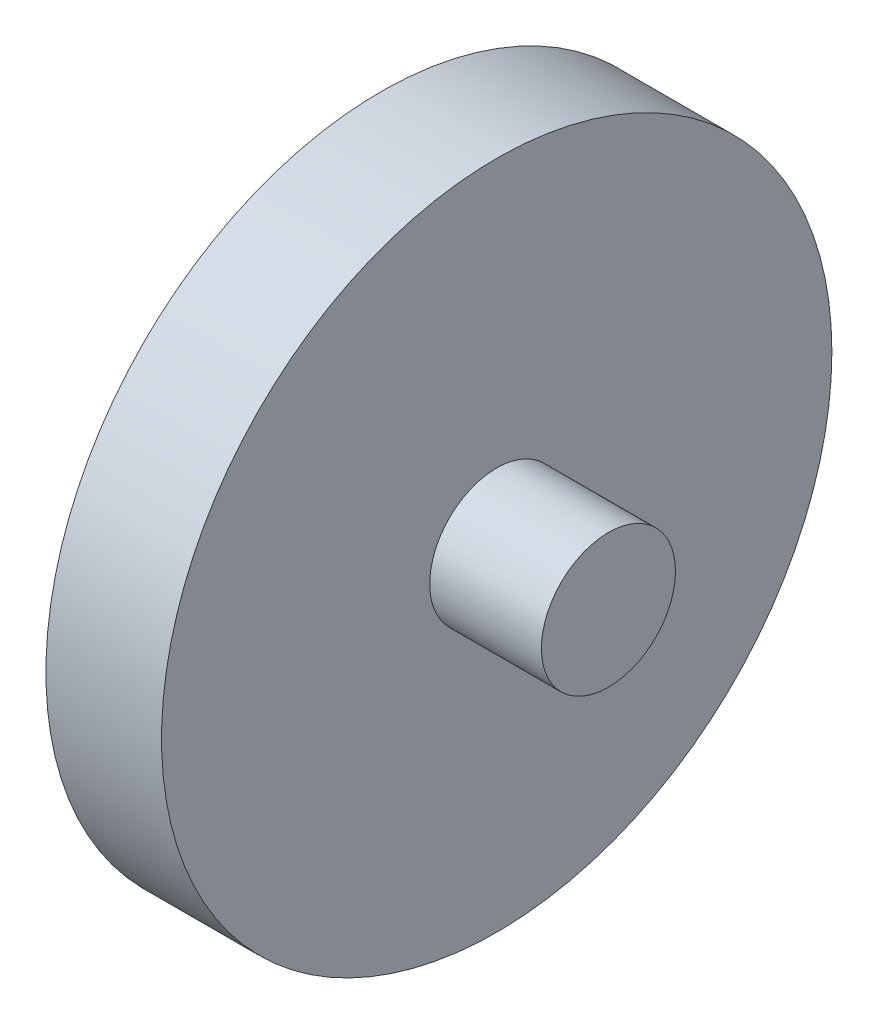
from build123d import *

# Parameters (mm, degrees)
SKETCH1_R           = 15
SKETCH1_W           = 3.175
SKETCH1_H           = 16.7
BOSS_EXTRUDE1_DEPTH = 4.175
SKETCH2_R           = 15
BOSS_EXTRUDE2_DEPTH = 1
SKETCH3_R           = 3
BOSS_EXTRUDE3_DEPTH = 5


with BuildPart() as part:
    # Sketch1 → Boss-Extrude1 (new body)
    with BuildSketch(Plane(origin=(0, 0, 0), x_dir=(0, 0, -1), z_dir=(1, 0, 0))):
        Circle(SKETCH1_R)
        Rectangle(SKETCH1_W, SKETCH1_H, mode=Mode.SUBTRACT)
    extrude(amount=BOSS_EXTRUDE1_DEPTH)

    # Sketch2 → Boss-Extrude2 (add)
    with BuildSketch(Plane(origin=(4.175, 0, 0), x_dir=(0, 0, -1), z_dir=(1, 0, 0))):
        Circle(SKETCH2_R)
    extrude(amount=BOSS_EXTRUDE2_DEPTH)

    # Sketch3 → Boss-Extrude3 (add)
    with BuildSketch(Plane(origin=(5.175, 0, 0), x_dir=(0, 0, -1), z_dir=(1, 0, 0))):
        Circle(SKETCH3_R)
    extrude(amount=BOSS_EXTRUDE3_DEPTH)


solid = part.part
